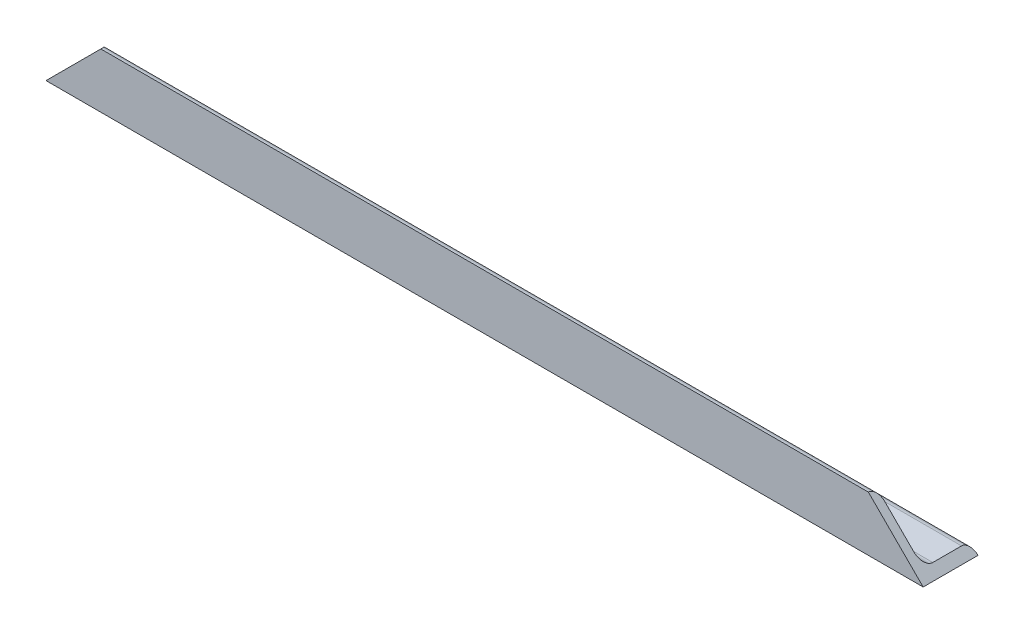
from build123d import *

# Parameters (mm, degrees)
L_ANGLE_EQUAL_20X20X3_1_DEPTH = 320
CUT_EXTRUDE1_DEPTH            = 322.247568084


with BuildPart() as part:
    # Sketch16 → L angle (equal) 20X20X3(1) (new body)
    with BuildSketch(Plane(origin=(0, 0, 0), x_dir=(0, 0, -1), z_dir=(1, 0, 0))):
        with BuildLine():
            Line((0, 20), (0, 0))
            Line((0, 0), (20, 0))
            ThreePointArc((20, 0), (19.121320344, 2.121320344), (17, 3))
            Line((17, 3), (6.5, 3))
            ThreePointArc((6.5, 3), (4.025126266, 4.025126266), (3, 6.5))
            Line((3, 6.5), (3, 17))
            ThreePointArc((3, 17), (2.121320344, 19.121320344), (0, 20))
        make_face()
    extrude(amount=L_ANGLE_EQUAL_20X20X3_1_DEPTH)

    # Sketch14 → Cut-Extrude1 (cut, through all)
    with BuildSketch(Plane.XY):
        Polygon((320, 0), (320, 20), (300, 20), align=None)
        Polygon((0, 20), (0, 0), (20, 20), align=None)
    extrude(amount=-CUT_EXTRUDE1_DEPTH, mode=Mode.SUBTRACT)


solid = part.part
